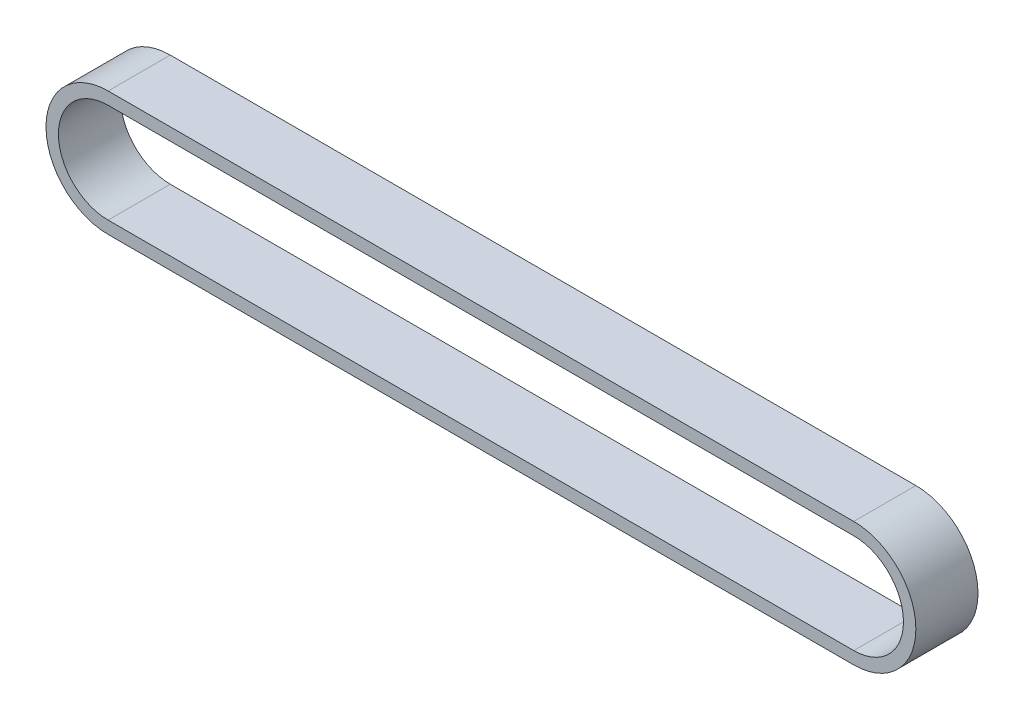
from build123d import *

# Parameters (mm, degrees)
EXTRUDE_1_DEPTH = 25


with BuildPart() as part:
    # 草图1 → 凸台-拉伸1 (new body)
    with BuildSketch(Plane.XY):
        with BuildLine():
            Line((0, 25), (300, 25))
            ThreePointArc((300, 25), (325, 0), (300, -25))
            Line((300, -25), (0, -25))
            ThreePointArc((0, -25), (-25, 0), (0, 25))
        make_face()
        with BuildLine():
            Line((0, 20), (300, 20))
            ThreePointArc((300, 20), (320, 0), (300, -20))
            Line((300, -20), (0, -20))
            ThreePointArc((0, -20), (-20, 0), (0, 20))
        make_face(mode=Mode.SUBTRACT)
    extrude(amount=EXTRUDE_1_DEPTH)


solid = part.part
